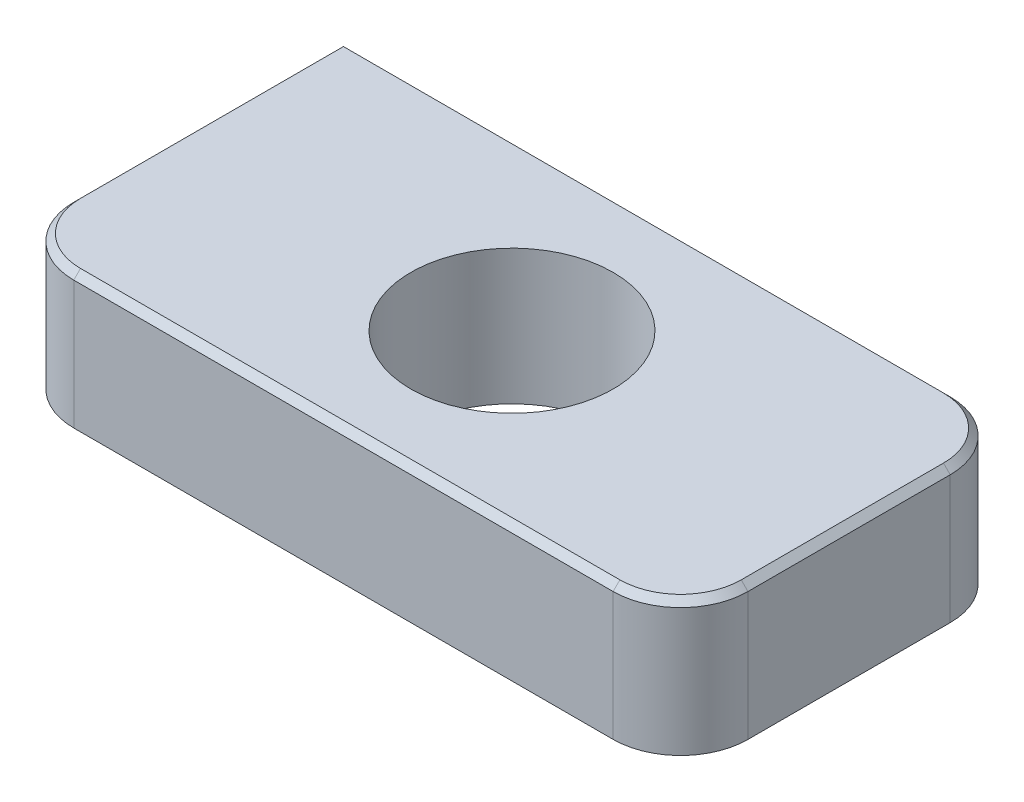
from build123d import *

# Parameters (mm, degrees)
SKETCH1_W           = 100
SKETCH1_H           = 50
BOSS_EXTRUDE1_DEPTH = 20
SKETCH2_R           = 15
CUT_EXTRUDE1_DEPTH  = 20
FILLET1_R           = 10
CHAMFER1_SIZE       = 1


with BuildPart() as part:
    # Sketch1 → Boss-Extrude1 (new body)
    with BuildSketch(Plane(origin=(0, 0, 0), x_dir=(1, 0, 0), z_dir=(0, 1, 0))):
        Rectangle(SKETCH1_W, SKETCH1_H)
    extrude(amount=BOSS_EXTRUDE1_DEPTH)

    # Sketch2 → Cut-Extrude1 (cut)
    with BuildSketch(Plane(origin=(0, 20, 0), x_dir=(1, 0, 0), z_dir=(0, 1, 0))):
        with Locations(Location((0, 0, 0), (0, 0, 270))):
            Circle(SKETCH2_R)
    extrude(amount=-CUT_EXTRUDE1_DEPTH, mode=Mode.SUBTRACT)

    # Fillet1
    fillet1_edges = [part.edges().sort_by_distance(p)[0] for p in [
        (50, 10, 25),
        (-50, 10, 25),
        (50, 10, -25),
    ]]
    fillet(fillet1_edges, radius=FILLET1_R)

    # Chamfer1
    chamfer1_edges = [part.edges().sort_by_distance(p)[0] for p in [
        (-50, 20, -5),
        (-5, 20, -25),
        (50, 20, 0),
        (0, 20, 25),
        (-47.071067812, 20, 22.071067812),
        (47.071067812, 20, 22.071067812),
        (47.071067812, 20, -22.071067812),
    ]]
    chamfer(chamfer1_edges, length=CHAMFER1_SIZE)


solid = part.part
